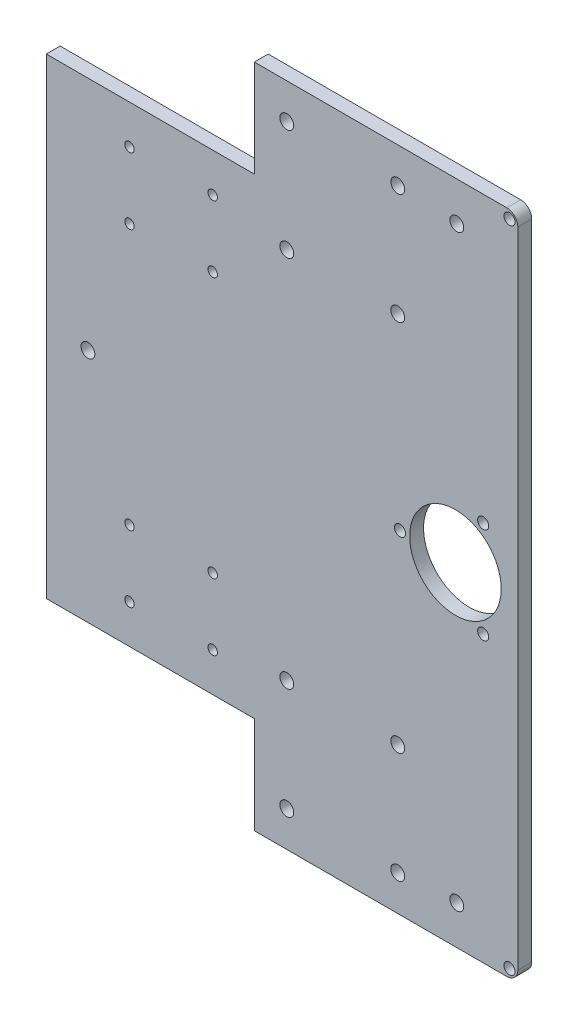
from build123d import *

# Parameters (mm, degrees)
SKETCH1_W           = 170
SKETCH1_H           = 240
BOSS_EXTRUDE1_DEPTH = 5
SKETCH2_R           = 16.5
CUT_EXTRUDE1_DEPTH  = 148.139389696
SKETCH3_R           = 2
CUT_EXTRUDE2_DEPTH  = 148.139389696
SKETCH4_R           = 1.7
CUT_EXTRUDE3_DEPTH  = 148.139389696
SKETCH5_W           = 75
SKETCH5_H           = 35
CUT_EXTRUDE4_DEPTH  = 148.139389696
FILLET1_R           = 4
SKETCH6_R           = 2.000000001
CUT_EXTRUDE5_DEPTH  = 148.139389696
FILLET2_R           = 4
SKETCH7_R           = 2.5
CUT_EXTRUDE6_DEPTH  = 148.139389696
SKETCH8_R           = 2.5
CUT_EXTRUDE7_DEPTH  = 148.139389696


with BuildPart() as part:
    # Sketch1 → Boss-Extrude1 (new body)
    with BuildSketch(Plane.XY):
        Rectangle(SKETCH1_W, SKETCH1_H)
    extrude(amount=BOSS_EXTRUDE1_DEPTH)

    # Sketch2 → Cut-Extrude1 (cut, through all)
    with BuildSketch(Plane.XY.offset(5)):
        with Locations((62.5, 0)):
            Circle(SKETCH2_R)
    extrude(amount=-CUT_EXTRUDE1_DEPTH, mode=Mode.SUBTRACT)

    # Sketch3 → Cut-Extrude2 (cut, through all)
    with BuildSketch(Plane.XY.offset(5)):
        with Locations((72.5, -17.320508076)):
            Circle(SKETCH3_R)
        with Locations((72.5, 17.320508076)):
            Circle(SKETCH3_R)
        with Locations((42.5, 0)):
            Circle(SKETCH3_R)
    extrude(amount=-CUT_EXTRUDE2_DEPTH, mode=Mode.SUBTRACT)

    # Sketch4 → Cut-Extrude3 (cut, through all)
    with BuildSketch(Plane.XY.offset(5)):
        with Locations((-25, 47)):
            Circle(SKETCH4_R)
        with Locations((-25, 71)):
            Circle(SKETCH4_R)
        with Locations((-55, 47)):
            Circle(SKETCH4_R)
        with Locations((-55, 71)):
            Circle(SKETCH4_R)
        with Locations(Location((-55, -71, 0), (0, 0, 180))):
            Circle(SKETCH4_R)
        with Locations(Location((-25, -71, 0), (0, 0, 180))):
            Circle(SKETCH4_R)
        with Locations(Location((-55, -47, 0), (0, 0, 180))):
            Circle(SKETCH4_R)
        with Locations(Location((-25, -47, 0), (0, 0, 180))):
            Circle(SKETCH4_R)
    extrude(amount=-CUT_EXTRUDE3_DEPTH, mode=Mode.SUBTRACT)

    # Sketch5 → Cut-Extrude4 (cut, through all)
    with BuildSketch(Plane.XY.offset(5)):
        with Locations((-47.5, 102.5)):
            Rectangle(SKETCH5_W, SKETCH5_H)
        with Locations((-47.5, -102.5)):
            Rectangle(SKETCH5_W, SKETCH5_H)
    extrude(amount=-CUT_EXTRUDE4_DEPTH, mode=Mode.SUBTRACT)

    # Fillet1
    fillet1_edges = [part.edges().sort_by_distance(p)[0] for p in [
        (85, -120, 2.5),
    ]]
    fillet(fillet1_edges, radius=FILLET1_R)

    # Sketch6 → Cut-Extrude5 (cut, through all)
    with BuildSketch(Plane.XY.offset(5)):
        with Locations((81.999999999, -117)):
            Circle(SKETCH6_R)
    cut_extrude5 = extrude(amount=-CUT_EXTRUDE5_DEPTH, mode=Mode.SUBTRACT)

    # Mirror5: Cut-Extrude5 across plane
    add(cut_extrude5.mirror(Plane.ZX), mode=Mode.SUBTRACT)

    # Fillet2
    fillet2_edges = [part.edges().sort_by_distance(p)[0] for p in [
        (85, 120, 2.5),
    ]]
    fillet(fillet2_edges, radius=FILLET2_R)

    # Sketch7 → Cut-Extrude6 (cut, through all)
    with BuildSketch(Plane.XY.offset(5)):
        with Locations((41.7, 107.25)):
            Circle(SKETCH7_R)
        with Locations((41.7, 67.25)):
            Circle(SKETCH7_R)
        with Locations((1.7, 67.25)):
            Circle(SKETCH7_R)
        with Locations((1.7, 107.25)):
            Circle(SKETCH7_R)
        with Locations((41.7, -107.25)):
            Circle(SKETCH7_R)
        with Locations((1.7, -107.25)):
            Circle(SKETCH7_R)
        with Locations((1.7, -67.25)):
            Circle(SKETCH7_R)
        with Locations((41.7, -67.25)):
            Circle(SKETCH7_R)
    extrude(amount=-CUT_EXTRUDE6_DEPTH, mode=Mode.SUBTRACT)

    # Sketch8 → Cut-Extrude7 (cut, through all)
    with BuildSketch(Plane(origin=(0, 0, 0), x_dir=(-1, 0, 0), z_dir=(0, 0, -1))):
        with Locations((-63, 106)):
            Circle(SKETCH8_R)
        with Locations((-63, -106)):
            Circle(SKETCH8_R)
        with Locations((70, 0)):
            Circle(SKETCH8_R)
    extrude(amount=-CUT_EXTRUDE7_DEPTH, mode=Mode.SUBTRACT)


solid = part.part
